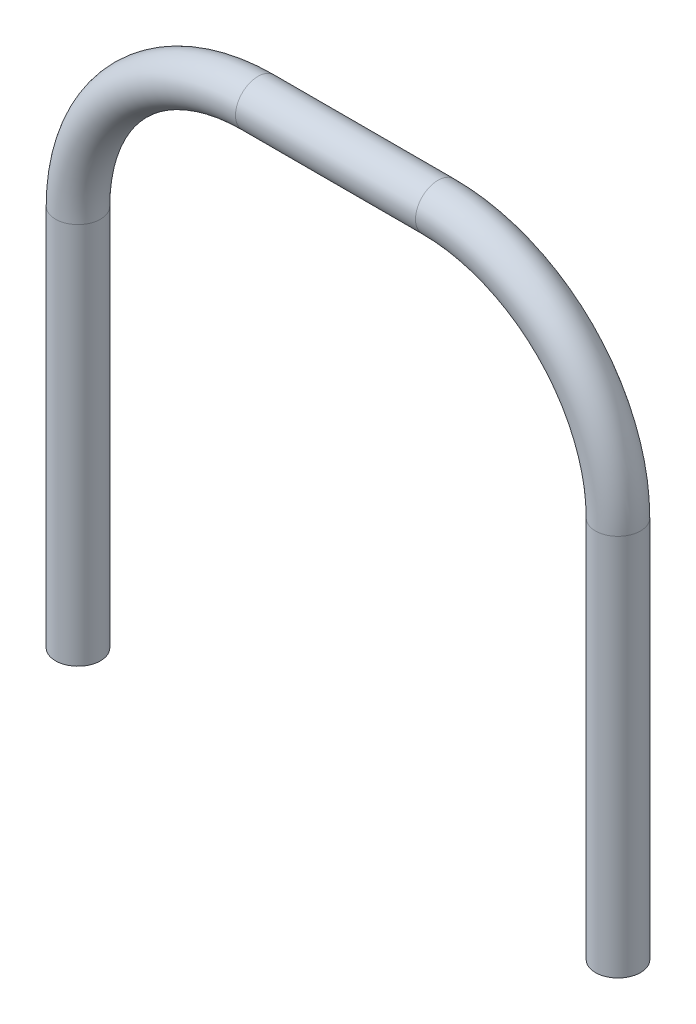
from build123d import *

# Parameters (mm, degrees)
SKETCH2_R          = 25.4
SKETCH3_R          = 23.749
CUT_EXTRUDE1_DEPTH = 363.22
SKETCH4_R          = 23.749
CUT_EXTRUDE2_DEPTH = 401.32


with BuildPart() as part:
    # Sweep1: sweep along a path in Sketch1
    with BuildLine(Plane.XY) as sweep1_path:
        Line((0, 0), (0, 431.8))
        ThreePointArc((0, 431.8), (59.515902063, 575.484097937), (203.2, 635))
        Line((203.2, 635), (406.4, 635))
        ThreePointArc((406.4, 635), (550.084097937, 575.484097937), (609.6, 431.8))
        Line((609.6, 431.8), (609.6, 0))
    # Sketch2 → Sweep1 (sweep)
    with BuildSketch(Plane(origin=(0, 0, 0), x_dir=(1, 0, 0), z_dir=(0, 1, 0))):
        Circle(SKETCH2_R)
    sweep(path=sweep1_path.line)

    # Sketch3 → Cut-Extrude1 (cut)
    with BuildSketch(Plane.XZ):
        with Locations(Location((0, 0, 0), (0, 0, 270))):
            Circle(SKETCH3_R)
    extrude(amount=-CUT_EXTRUDE1_DEPTH, mode=Mode.SUBTRACT)

    # Sketch4 → Cut-Extrude2 (cut)
    with BuildSketch(Plane.XZ):
        with Locations((609.6, 0)):
            Circle(SKETCH4_R)
    extrude(amount=-CUT_EXTRUDE2_DEPTH, mode=Mode.SUBTRACT)


solid = part.part
